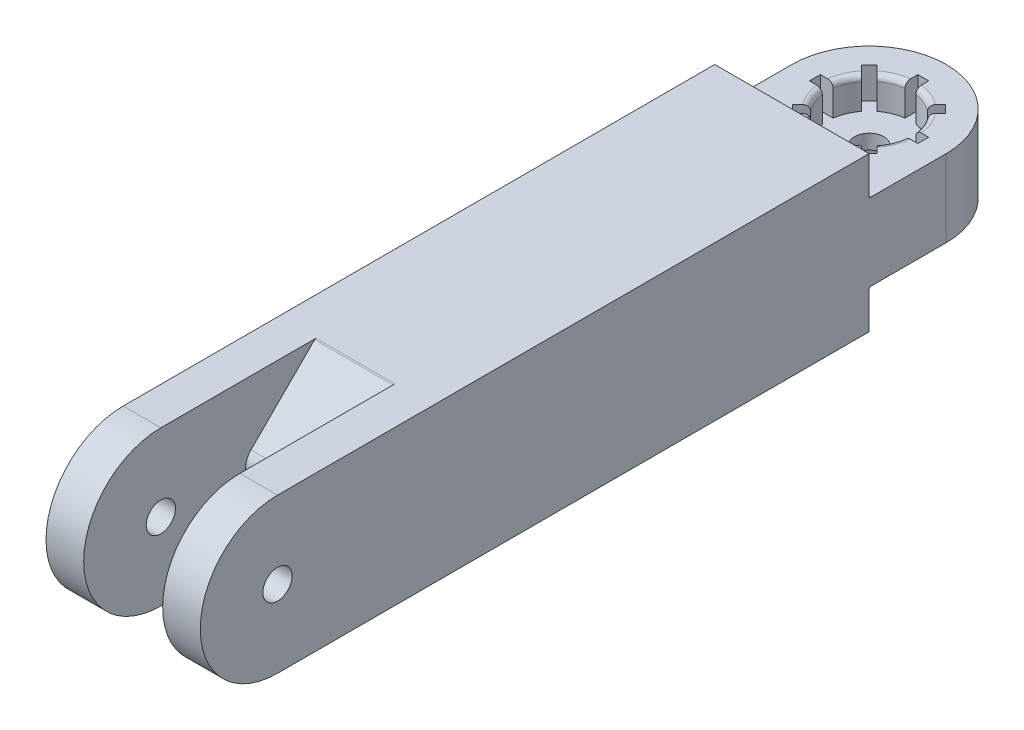
from build123d import *

# Parameters (mm, degrees)
SKETCH1_W               = 42
SKETCH1_H               = 42
BOSS_EXTRUDE1_DEPTH     = 140
SKETCH2_W               = 10.25
SKETCH2_H               = 42
BOSS_EXTRUDE2_DEPTH     = 21
BOSS_EXTRUDE4_DEPTH     = 10.25
BOSS_EXTRUDE5_START     = -10.25
BOSS_EXTRUDE5_DEPTH     = 10.25
SKETCH6_R               = 3.975
CUT_EXTRUDE1_DEPTH      = 186.93832983
SKETCH8_R               = 3.975
CUT_EXTRUDE2_DEPTH      = 186.93832983
SKETCH9_W               = 42
SKETCH9_H               = 21
BOSS_EXTRUDE6_DEPTH     = 21
BOSS_EXTRUDE7_DEPTH     = 21
SKETCH11_R              = 11.35
CUT_EXTRUDE3_DEPTH      = 8.5
CUT_EXTRUDE4_DEPTH      = 21.5
FILLET1_R               = 5
CUT_EXTRUDE5_START      = -8.5
SKETCH18_R              = 11.35
CUT_EXTRUDE5_DEPTH      = 8.5
SKETCH19_R              = 3.975
CUT_EXTRUDE6_DEPTH      = 8.5
FILLET4_R               = 1.5
FILLET5_R               = 1.5
SKETCH20_W              = 2.96
SKETCH20_H              = 3.81
CUT_EXTRUDE7_DEPTH      = 8.5
CIRPATTERN1_COUNT       = 8
MIRROR1_COPY_1_SKETCH_W = 2.96
MIRROR1_COPY_1_SKETCH_H = 3.81
MIRROR1_COPY_1_DEPTH    = 8.5
MIRROR1_COPY_2_SKETCH_W = 2.96
MIRROR1_COPY_2_SKETCH_H = 3.81
MIRROR1_COPY_2_DEPTH    = 8.5
MIRROR1_COPY_3_SKETCH_W = 2.96
MIRROR1_COPY_3_SKETCH_H = 3.81
MIRROR1_COPY_3_DEPTH    = 8.5
MIRROR1_COPY_4_SKETCH_W = 2.96
MIRROR1_COPY_4_SKETCH_H = 3.81
MIRROR1_COPY_4_DEPTH    = 8.5
MIRROR1_COPY_5_SKETCH_W = 2.96
MIRROR1_COPY_5_SKETCH_H = 3.81
MIRROR1_COPY_5_DEPTH    = 8.5
MIRROR1_COPY_6_SKETCH_W = 2.96
MIRROR1_COPY_6_SKETCH_H = 3.81
MIRROR1_COPY_6_DEPTH    = 8.5
MIRROR1_COPY_7_SKETCH_W = 2.96
MIRROR1_COPY_7_SKETCH_H = 3.81
MIRROR1_COPY_7_DEPTH    = 8.5
FILLET6_R               = 0.5
FILLET7_R               = 0.5
FILLET8_R               = 0.5
FILLET9_R               = 0.5


with BuildPart() as part:
    # Sketch1 → Boss-Extrude1 (new body)
    with BuildSketch(Plane.XY):
        Rectangle(SKETCH1_W, SKETCH1_H)
    extrude(amount=BOSS_EXTRUDE1_DEPTH)

    # Sketch2 → Boss-Extrude2 (add)
    with BuildSketch(Plane.XY.offset(140)):
        with Locations((-15.875, 0)):
            Rectangle(SKETCH2_W, SKETCH2_H)
        with Locations((15.875, 0)):
            Rectangle(SKETCH2_W, SKETCH2_H)
    extrude(amount=BOSS_EXTRUDE2_DEPTH)

    # Sketch5 → Boss-Extrude4 (add)
    with BuildSketch(Plane.ZY.offset(-10.75)):
        with BuildLine():
            ThreePointArc((161, 21), (182, 0), (161, -21))
            Line((161, -21), (161, 21))
        make_face()
    extrude(amount=-BOSS_EXTRUDE4_DEPTH)

    # Sketch3 → Boss-Extrude5 (add)
    with BuildSketch(Plane(origin=(-10.75, 0, 0), x_dir=(0, 0, -1), z_dir=(1, 0, 0)).offset(BOSS_EXTRUDE5_START)):
        with BuildLine():
            Line((-161, -21), (-161, 21))
            ThreePointArc((-161, 21), (-182, 0), (-161, -21))
        make_face()
    extrude(amount=BOSS_EXTRUDE5_DEPTH)

    # Sketch6 → Cut-Extrude1 (cut, through all)
    with BuildSketch(Plane.ZY.offset(-10.75)):
        with Locations(Location((161, 0, 0), (0, 0, 270))):
            Circle(SKETCH6_R)
    extrude(amount=-CUT_EXTRUDE1_DEPTH, mode=Mode.SUBTRACT)

    # Sketch8 → Cut-Extrude2 (cut, through all)
    with BuildSketch(Plane(origin=(-10.75, 0, 0), x_dir=(0, 0, -1), z_dir=(1, 0, 0))):
        with Locations(Location((-161, 0, 0), (0, 0, 270))):
            Circle(SKETCH8_R)
    extrude(amount=-CUT_EXTRUDE2_DEPTH, mode=Mode.SUBTRACT)

    # Sketch9 → Boss-Extrude6 (add)
    with BuildSketch(Plane(origin=(0, 0, 0), x_dir=(-1, 0, 0), z_dir=(0, 0, -1))):
        Rectangle(SKETCH9_W, SKETCH9_H)
    extrude(amount=BOSS_EXTRUDE6_DEPTH)

    # Sketch10 → Boss-Extrude7 (add)
    with BuildSketch(Plane(origin=(0, -10.5, 0), x_dir=(-1, 0, 0), z_dir=(0, -1, 0))):
        with BuildLine():
            Line((-21, 21), (21, 21))
            ThreePointArc((21, 21), (0, 42), (-21, 21))
        make_face()
    extrude(amount=-BOSS_EXTRUDE7_DEPTH)

    # Sketch11 → Cut-Extrude3 (cut)
    with BuildSketch(Plane(origin=(0, -10.5, 0), x_dir=(-1, 0, 0), z_dir=(0, -1, 0))):
        with Locations(Location((0, 21, 0), (0, 0, 180))):
            Circle(SKETCH11_R)
    extrude(amount=-CUT_EXTRUDE3_DEPTH, mode=Mode.SUBTRACT)

    # Sketch16 → Cut-Extrude4 (cut)
    with BuildSketch(Plane.ZY.offset(-10.75)):
        Polygon((140, -21), (140, 0), (119, -21), align=None)
        Polygon((140, 0), (140, 21), (119, 21), align=None)
    extrude(amount=CUT_EXTRUDE4_DEPTH, mode=Mode.SUBTRACT)

    # Fillet1
    fillet1_edges = [part.edges().sort_by_distance(p)[0] for p in [
        (0, 0, 140),
    ]]
    fillet(fillet1_edges, radius=FILLET1_R)

    # Sketch18 → Cut-Extrude5 (cut)
    with BuildSketch(Plane(origin=(0, 10.5, 0), x_dir=(1, 0, 0), z_dir=(0, 1, 0)).offset(CUT_EXTRUDE5_START)):
        with Locations((0, 21)):
            Circle(SKETCH18_R)
    extrude(amount=CUT_EXTRUDE5_DEPTH, mode=Mode.SUBTRACT)

    # Sketch19 → Cut-Extrude6 (cut)
    with BuildSketch(Plane.XZ.offset(2)):
        with Locations((0, -21)):
            Circle(SKETCH19_R)
    extrude(amount=-CUT_EXTRUDE6_DEPTH, mode=Mode.SUBTRACT)

    # Fillet4
    fillet4_edges = [part.edges().sort_by_distance(p)[0] for p in [
        (-11.35, -10.5, -21),
    ]]
    fillet(fillet4_edges, radius=FILLET4_R)

    # Fillet5
    fillet5_edges = [part.edges().sort_by_distance(p)[0] for p in [
        (-11.35, 10.5, -21),
    ]]
    fillet(fillet5_edges, radius=FILLET5_R)

    # Sketch20 → Cut-Extrude7 (cut)
    with BuildSketch(Plane(origin=(0, 10.5, 0), x_dir=(1, 0, 0), z_dir=(0, 1, 0))):
        with Locations((0, 33.85)):
            Rectangle(SKETCH20_W, SKETCH20_H)
    cut_extrude7 = extrude(amount=-CUT_EXTRUDE7_DEPTH, mode=Mode.SUBTRACT)

    # CirPattern1: Cut-Extrude7 ×8 about axis
    cirpattern1_axis = Axis((0, 0, -21), (0, 1, 0))
    for i in range(1, CIRPATTERN1_COUNT):
        add(cut_extrude7.rotate(cirpattern1_axis, i * 360 / CIRPATTERN1_COUNT), mode=Mode.SUBTRACT)

    # Mirror1: Cut-Extrude7 across plane
    add(cut_extrude7.mirror(Plane.ZX), mode=Mode.SUBTRACT)

    # Mirror1 copy 1 sketch → Mirror1 copy 1 (cut)
    with BuildSketch(Plane(origin=(14.849242405, -10.5, -6.150757595), x_dir=(0.7071067811865476, 0, -0.7071067811865475), z_dir=(0, -1, 0))):
        with Locations((0, -33.85)):
            Rectangle(MIRROR1_COPY_1_SKETCH_W, MIRROR1_COPY_1_SKETCH_H)
    extrude(amount=-MIRROR1_COPY_1_DEPTH, mode=Mode.SUBTRACT)

    # Mirror1 copy 2 sketch → Mirror1 copy 2 (cut)
    with BuildSketch(Plane(origin=(21, -10.5, -21), x_dir=(0, 0, -1), z_dir=(0, -1, 0))):
        with Locations((0, -33.85)):
            Rectangle(MIRROR1_COPY_2_SKETCH_W, MIRROR1_COPY_2_SKETCH_H)
    extrude(amount=-MIRROR1_COPY_2_DEPTH, mode=Mode.SUBTRACT)

    # Mirror1 copy 3 sketch → Mirror1 copy 3 (cut)
    with BuildSketch(Plane(origin=(14.849242405, -10.5, -35.849242405), x_dir=(-0.7071067811865475, 0, -0.7071067811865476), z_dir=(0, -1, 0))):
        with Locations((0, -33.85)):
            Rectangle(MIRROR1_COPY_3_SKETCH_W, MIRROR1_COPY_3_SKETCH_H)
    extrude(amount=-MIRROR1_COPY_3_DEPTH, mode=Mode.SUBTRACT)

    # Mirror1 copy 4 sketch → Mirror1 copy 4 (cut)
    with BuildSketch(Plane(origin=(0, -10.5, -42), x_dir=(-1, 0, 0), z_dir=(0, -1, 0))):
        with Locations((0, -33.85)):
            Rectangle(MIRROR1_COPY_4_SKETCH_W, MIRROR1_COPY_4_SKETCH_H)
    extrude(amount=-MIRROR1_COPY_4_DEPTH, mode=Mode.SUBTRACT)

    # Mirror1 copy 5 sketch → Mirror1 copy 5 (cut)
    with BuildSketch(Plane(origin=(-14.849242405, -10.5, -35.849242405), x_dir=(-0.7071067811865477, 0, 0.7071067811865475), z_dir=(0, -1, 0))):
        with Locations((0, -33.85)):
            Rectangle(MIRROR1_COPY_5_SKETCH_W, MIRROR1_COPY_5_SKETCH_H)
    extrude(amount=-MIRROR1_COPY_5_DEPTH, mode=Mode.SUBTRACT)

    # Mirror1 copy 6 sketch → Mirror1 copy 6 (cut)
    with BuildSketch(Plane(origin=(-21, -10.5, -21), x_dir=(0, 0, 1), z_dir=(0, -1, 0))):
        with Locations((0, -33.85)):
            Rectangle(MIRROR1_COPY_6_SKETCH_W, MIRROR1_COPY_6_SKETCH_H)
    extrude(amount=-MIRROR1_COPY_6_DEPTH, mode=Mode.SUBTRACT)

    # Mirror1 copy 7 sketch → Mirror1 copy 7 (cut)
    with BuildSketch(Plane(origin=(-14.849242405, -10.5, -6.150757595), x_dir=(0.7071067811865474, 0, 0.7071067811865477), z_dir=(0, -1, 0))):
        with Locations((0, -33.85)):
            Rectangle(MIRROR1_COPY_7_SKETCH_W, MIRROR1_COPY_7_SKETCH_H)
    extrude(amount=-MIRROR1_COPY_7_DEPTH, mode=Mode.SUBTRACT)

    # Fillet6
    fillet6_edges = [part.edges().sort_by_distance(p)[0] for p in [
        (0, -10.5, 0),
    ]]
    fillet(fillet6_edges, radius=FILLET6_R)

    # Fillet7
    fillet7_edges = [part.edges().sort_by_distance(p)[0] for p in [
        (0, 10.5, 0),
    ]]
    fillet(fillet7_edges, radius=FILLET7_R)

    # Fillet8
    fillet8_edges = [part.edges().sort_by_distance(p)[0] for p in [
        (0, -21, 119),
    ]]
    fillet(fillet8_edges, radius=FILLET8_R)

    # Fillet9
    fillet9_edges = [part.edges().sort_by_distance(p)[0] for p in [
        (0, 21, 119),
    ]]
    fillet(fillet9_edges, radius=FILLET9_R)


solid = part.part
